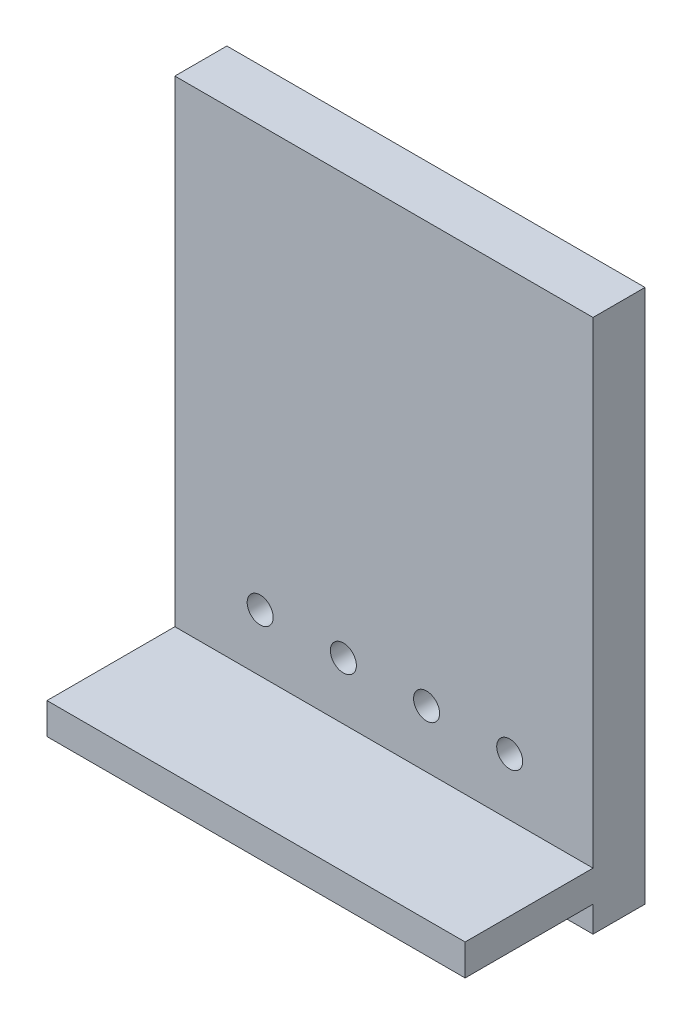
from build123d import *

# Parameters (mm, degrees)
SKETCH1_W           = 40.2
SKETCH1_H           = 51.35
BOSS_EXTRUDE1_DEPTH = 5
BOSS_EXTRUDE2_DEPTH = 12.295
SKETCH4_R           = 1.249999996
SKETCH4_R_2         = 1.249999994
CUT_EXTRUDE1_DEPTH  = 10


with BuildPart() as part:
    # Sketch1 → Boss-Extrude1 (new body)
    with BuildSketch(Plane.XY):
        with Locations((-33.356876364, -1261.35554294)):
            Rectangle(SKETCH1_W, SKETCH1_H)
    extrude(amount=BOSS_EXTRUDE1_DEPTH)

    # Sketch2 → Boss-Extrude2 (add)
    with BuildSketch(Plane.XY.offset(5)):
        Polygon((-53.456876364, -1281.53054294), (-53.456876364, -1283.03054294), (-53.456876364, -1284.53054294), (-13.256876364, -1284.53054294), (-13.256876364, -1281.53054294), align=None)
    extrude(amount=BOSS_EXTRUDE2_DEPTH)

    # Sketch4 → Cut-Extrude1 (cut)
    with BuildSketch(Plane.XY.offset(5)):
        with Locations((-45.256876364, -1276.030542925)):
            Circle(SKETCH4_R)
        with Locations((-37.256876364, -1276.030542925)):
            Circle(SKETCH4_R_2)
        with Locations((-29.256876364, -1276.03054293)):
            Circle(SKETCH4_R)
        with Locations((-21.26485567, -1276.03054293)):
            Circle(SKETCH4_R)
    extrude(amount=-CUT_EXTRUDE1_DEPTH, mode=Mode.SUBTRACT)


solid = part.part
